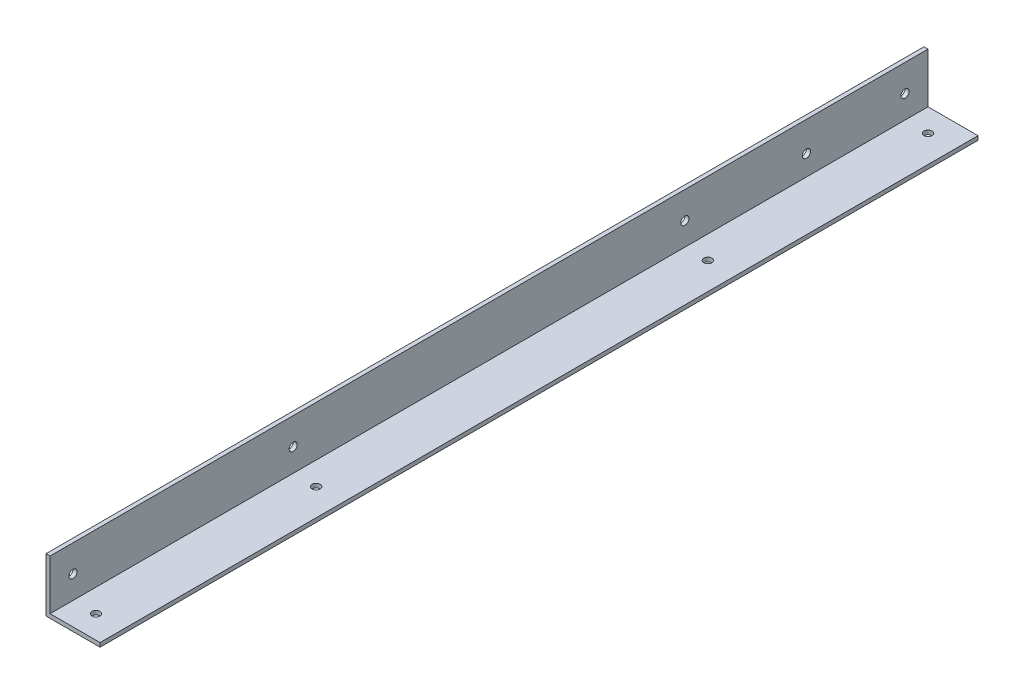
from build123d import *

# Parameters (mm, degrees)
EXTRUSION1_DEPTH = 325
ESQUISSE2_R      = 1.5
EXTRUSION2_DEPTH = 300
ESQUISSE3_R      = 1.5
EXTRUSION3_DEPTH = 300


with BuildPart() as part:
    # Esquisse1 → Extrusion1 (new body)
    with BuildSketch(Plane.XY):
        Polygon((-17.43168638, 4.773368421), (-17.43168638, -15.226631579), (2.56831362, -15.226631579), (2.56831362, -13.726631579), (-15.93168638, -13.726631579), (-15.93168638, 4.773368421), align=None)
    extrude(amount=EXTRUSION1_DEPTH)

    # Esquisse2 → Extrusion2 (cut)
    with BuildSketch(Plane(origin=(0, -13.726631579, 0), x_dir=(-1, 0, 0), z_dir=(0, 1, 0))):
        with Locations((7.43168638, 8.5)):
            Circle(ESQUISSE2_R)
        with Locations((7.43168638, 316.5)):
            Circle(ESQUISSE2_R)
        with Locations((7.43168638, 235)):
            Circle(ESQUISSE2_R)
        with Locations((7.43168638, 90)):
            Circle(ESQUISSE2_R)
    extrude(amount=-EXTRUSION2_DEPTH, mode=Mode.SUBTRACT)

    # Esquisse3 → Extrusion3 (cut)
    with BuildSketch(Plane(origin=(-15.93168638, 0, 0), x_dir=(0, 0, -1), z_dir=(1, 0, 0))):
        with Locations((-316.5, -5.226631579)):
            Circle(ESQUISSE3_R)
        with Locations((-8.5, -5.226631579)):
            Circle(ESQUISSE3_R)
        with Locations((-235, -5.226631579)):
            Circle(ESQUISSE3_R)
        with Locations((-90, -5.226631579)):
            Circle(ESQUISSE3_R)
        with Locations((-45, -6.226631579)):
            Circle(ESQUISSE3_R)
    extrude(amount=-EXTRUSION3_DEPTH, mode=Mode.SUBTRACT)


solid = part.part
